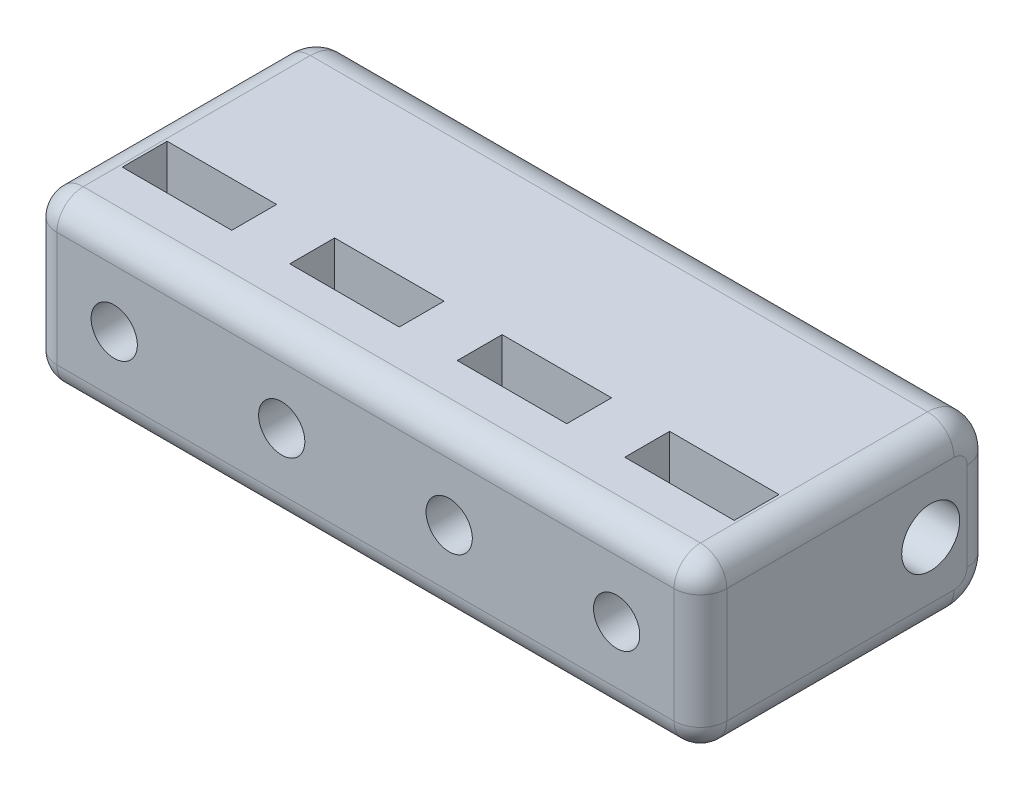
from build123d import *

# Parameters (mm, degrees)
SKETCH1_W           = 50.8
SKETCH1_H           = 22.225
BOSS_EXTRUDE1_DEPTH = 12.7
SKETCH2_R           = 2.2
CUT_EXTRUDE1_DEPTH  = 57.884801353
SKETCH4_R           = 1.7525
CUT_EXTRUDE3_DEPTH  = 3.4
CUT_EXTRUDE4_START  = -3.4
SKETCH4_3_R         = 1.7525
CUT_EXTRUDE4_DEPTH  = 1
CUT_EXTRUDE5_REACH  = 57.198
SKETCH4_4_R         = 1.7525
FILLET1_R           = 3
FILLET2_R           = 2
FILLET3_R           = 2


with BuildPart() as part:
    # Sketch1 → Boss-Extrude1 (new body)
    with BuildSketch(Plane(origin=(0, 0, 0), x_dir=(1, 0, 0), z_dir=(0, 1, 0))):
        with Locations((-25.4, -11.1125)):
            Rectangle(SKETCH1_W, SKETCH1_H)
    extrude(amount=BOSS_EXTRUDE1_DEPTH)

    # Sketch2 → Cut-Extrude1 (cut, through all)
    with BuildSketch(Plane.ZY.offset(50.8)):
        with Locations((4.7625, 6.35)):
            Circle(SKETCH2_R)
    extrude(amount=-CUT_EXTRUDE1_DEPTH, mode=Mode.SUBTRACT)

    # Sketch4 → Cut-Extrude3 (cut)
    # profile 1 of 9: a face of its own
    with BuildSketch(Plane.XY.offset(17.4625)):
        Polygon((-40.3, 12.7), (-40.3, 8.746003617), (-44.45, 11.142007234), (-48.6, 8.746003617), (-48.6, 12.7), align=None)
    # profile 2 of 9: a face of its own
    with BuildSketch(Plane.XY.offset(17.4625)):
        Polygon((-48.6, 8.746003617), (-48.6, 3.953996383), (-44.45, 1.557992766), (-40.3, 3.953996383), (-40.3, 8.746003617), (-44.45, 11.142007234), align=None)
        with Locations((-44.45, 6.35)):
            Circle(SKETCH4_R, mode=Mode.SUBTRACT)
    # profile 3 of 9: a face of its own
    with BuildSketch(Plane.XY.offset(17.4625)):
        Polygon((-35.9, 12.7), (-27.6, 12.7), (-27.6, 8.746003617), (-27.6, 3.953996383), (-31.75, 1.557992766), (-35.9, 3.953996383), (-35.9, 8.746003617), align=None)
        with Locations((-31.75, 6.35)):
            Circle(SKETCH4_R, mode=Mode.SUBTRACT)
    # profile 4 of 9: a face of its own
    with BuildSketch(Plane.XY.offset(17.4625)):
        with Locations((-31.75, 6.35)):
            Circle(SKETCH4_R)
    # profile 5 of 9: a face of its own
    with BuildSketch(Plane.XY.offset(17.4625)):
        with Locations((-44.45, 6.35)):
            Circle(SKETCH4_R)
    # profile 6 of 9: a face of its own
    with BuildSketch(Plane.XY.offset(17.4625)):
        Polygon((-23.2, 12.7), (-14.9, 12.7), (-14.9, 8.746003617), (-14.9, 3.953996383), (-19.05, 1.557992766), (-23.2, 3.953996383), (-23.2, 8.746003617), align=None)
        with Locations((-19.05, 6.35)):
            Circle(SKETCH4_R, mode=Mode.SUBTRACT)
    # profile 7 of 9: a face of its own
    with BuildSketch(Plane.XY.offset(17.4625)):
        with Locations((-19.05, 6.35)):
            Circle(SKETCH4_R)
    # profile 8 of 9: a face of its own
    with BuildSketch(Plane.XY.offset(17.4625)):
        Polygon((-10.5, 12.7), (-2.2, 12.7), (-2.2, 8.746003617), (-2.2, 3.953996383), (-6.35, 1.557992766), (-10.5, 3.953996383), (-10.5, 8.746003617), align=None)
        with Locations((-6.35, 6.35)):
            Circle(SKETCH4_R, mode=Mode.SUBTRACT)
    # profile 9 of 9: a face of its own
    with BuildSketch(Plane.XY.offset(17.4625)):
        with Locations((-6.35, 6.35)):
            Circle(SKETCH4_R)
    extrude(amount=-CUT_EXTRUDE3_DEPTH, mode=Mode.SUBTRACT)

    # Sketch4<3> → Cut-Extrude4 (cut)
    with BuildSketch(Plane.XY.offset(17.4625).offset(CUT_EXTRUDE4_START)):
        with Locations((-44.45, 6.35)):
            Circle(SKETCH4_3_R)
        with Locations((-31.75, 6.35)):
            Circle(SKETCH4_3_R)
        with Locations((-19.05, 6.35)):
            Circle(SKETCH4_3_R)
        with Locations((-6.35, 6.35)):
            Circle(SKETCH4_3_R)
    extrude(amount=-CUT_EXTRUDE4_DEPTH, mode=Mode.SUBTRACT)

    # Sketch4<4> → Cut-Extrude5 (cut, up to next)
    with BuildSketch(Plane.XY.offset(17.4625), mode=Mode.PRIVATE) as cut_extrude5_sk1:
        with Locations((-44.45, 6.35)):
            Circle(SKETCH4_4_R)
    cut_extrude5_tool1 = extrude(cut_extrude5_sk1.sketch, amount=CUT_EXTRUDE5_REACH, mode=Mode.PRIVATE) & part.part
    # Sketch4<4> → Cut-Extrude5 (cut, up to next)
    with BuildSketch(Plane.XY.offset(17.4625), mode=Mode.PRIVATE) as cut_extrude5_sk2:
        with Locations((-31.75, 6.35)):
            Circle(SKETCH4_4_R)
    cut_extrude5_tool2 = extrude(cut_extrude5_sk2.sketch, amount=CUT_EXTRUDE5_REACH, mode=Mode.PRIVATE) & part.part
    # Sketch4<4> → Cut-Extrude5 (cut, up to next)
    with BuildSketch(Plane.XY.offset(17.4625), mode=Mode.PRIVATE) as cut_extrude5_sk3:
        with Locations((-19.05, 6.35)):
            Circle(SKETCH4_4_R)
    cut_extrude5_tool3 = extrude(cut_extrude5_sk3.sketch, amount=CUT_EXTRUDE5_REACH, mode=Mode.PRIVATE) & part.part
    # Sketch4<4> → Cut-Extrude5 (cut, up to next)
    with BuildSketch(Plane.XY.offset(17.4625), mode=Mode.PRIVATE) as cut_extrude5_sk4:
        with Locations((-6.35, 6.35)):
            Circle(SKETCH4_4_R)
    cut_extrude5_tool4 = extrude(cut_extrude5_sk4.sketch, amount=CUT_EXTRUDE5_REACH, mode=Mode.PRIVATE) & part.part
    add(cut_extrude5_tool1.solids().sort_by_distance((-44.45, 6.35, 17.4625))[0], mode=Mode.SUBTRACT)
    add(cut_extrude5_tool2.solids().sort_by_distance((-31.75, 6.35, 17.4625))[0], mode=Mode.SUBTRACT)
    add(cut_extrude5_tool3.solids().sort_by_distance((-19.05, 6.35, 17.4625))[0], mode=Mode.SUBTRACT)
    add(cut_extrude5_tool4.solids().sort_by_distance((-6.35, 6.35, 17.4625))[0], mode=Mode.SUBTRACT)

    # Fillet1
    fillet1_edges = [part.edges().sort_by_distance(p)[0] for p in [
        (-25.4, 0, 0),
        (-25.4, 12.7, 0),
    ]]
    fillet(fillet1_edges, radius=FILLET1_R)

    # Fillet2
    fillet2_edges = [part.edges().sort_by_distance(p)[0] for p in [
        (-25.4, 12.7, 22.225),
        (-25.4, 0, 22.225),
    ]]
    fillet(fillet2_edges, radius=FILLET2_R)

    # Fillet3
    fillet3_edges = [part.edges().sort_by_distance(p)[0] for p in [
        (-50.8, 6.35, 0),
        (0, 6.35, 0),
        (-50.8, 0, 11.6125),
        (-50.8, 12.7, 11.6125),
        (-50.8, 11.821320344, 0.878679656),
        (-50.8, 0.878679656, 0.878679656),
        (0, 11.821320344, 0.878679656),
        (0, 0.878679656, 0.878679656),
        (0, 6.35, 22.225),
        (-50.8, 6.35, 22.225),
        (0, 0, 11.6125),
        (0, 12.7, 11.6125),
        (0, 12.114213562, 21.639213562),
        (0, 0.585786438, 21.639213562),
        (-50.8, 12.114213562, 21.639213562),
        (-50.8, 0.585786438, 21.639213562),
    ]]
    fillet(fillet3_edges, radius=FILLET3_R)


solid = part.part
